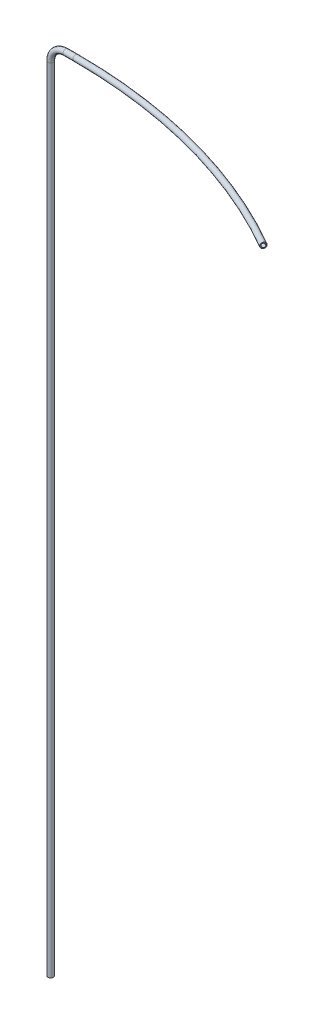
from build123d import *

# Parameters (mm, degrees)
SKETCH_1_R      = 6
SKETCH_1_R_2    = 4
REVOLVE_1_ANGLE = 30
SKETCH_2_R      = 15
SKETCH_2_R_2    = 10
SKETCH_2_R_3    = 6
SKETCH_2_R_4    = 4
SKETCH_11_R     = 6
SKETCH_11_R_2   = 4
EXTRUDE_1_DEPTH = 800


with BuildPart() as part:
    # 草图1 → 旋转1 (revolve)
    with BuildSketch(Plane(origin=(0, 0, 0), x_dir=(0, 0, -1), z_dir=(1, 0, 0))):
        with Locations((1300, -0.371055822)):
            Circle(SKETCH_1_R)
        with Locations((1300, -0.371055822)):
            Circle(SKETCH_1_R_2, mode=Mode.SUBTRACT)
    revolve(axis=Axis((0, 0, -200), (0, -1, 0)), revolution_arc=REVOLVE_1_ANGLE)

    # 扫描1: sweep along a path in 草图3
    with BuildLine(Plane.YX.offset(500)) as sweep_1_path:
        Line((0, 0), (0, -21.341132523))
        ThreePointArc((0, -21.341132523), (-9.589995058, -44.493428655), (-32.742291189, -54.083423712))
        Line((-32.742291189, -54.083423712), (-932.742291189, -54.083423712))
    # 草图2 → 扫描1 (sweep)
    # profile 1 of 2: a face of its own
    with BuildSketch(Plane.ZY):
        with Locations((-500, -0.371055822)):
            Circle(SKETCH_2_R)
        with Locations((-500, -0.371055822)):
            Circle(SKETCH_2_R_2, mode=Mode.SUBTRACT)
    # profile 2 of 2: a face of its own
    with BuildSketch(Plane.ZY):
        with Locations((-1300, -0.371055822)):
            Circle(SKETCH_2_R_3)
        with Locations((-1300, -0.371055822)):
            Circle(SKETCH_2_R_4, mode=Mode.SUBTRACT)
    sweep(path=sweep_1_path.line)


with BuildPart() as sweep_1_kept_piece:
    # of the separate pieces the step leaves, the one the design keeps (sweep_1_pieces_kept)
    add(part.part.solids().sort_by_distance((0, -0.371055822, -1306))[0])

    # 草图11 → 凸台-拉伸1 (add)
    with BuildSketch(Plane.XZ.offset(932.742291189)):
        with Locations((-53.712367891, -1300)):
            Circle(SKETCH_11_R)
        with Locations((-53.712367891, -1300)):
            Circle(SKETCH_11_R_2, mode=Mode.SUBTRACT)
    extrude(amount=EXTRUDE_1_DEPTH)


solid = sweep_1_kept_piece.part
